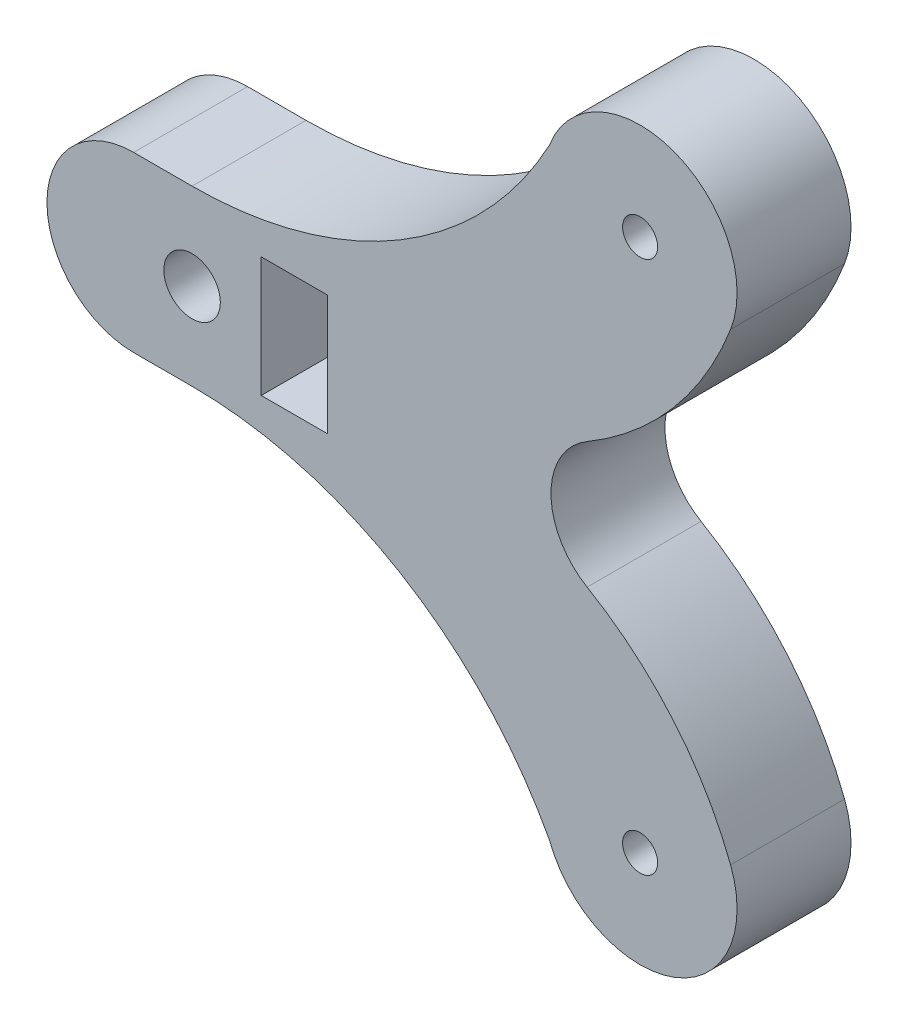
from build123d import *

# Parameters (mm, degrees)
SKETCH1_R           = 0.899963
SKETCH1_R_2         = 1.449813
SKETCH1_W           = 3.400011
SKETCH1_H           = 6.165182777
BOSS_EXTRUDE1_DEPTH = 5.85


with BuildPart() as part:
    # Sketch1 → Boss-Extrude1 (new body)
    with BuildSketch(Plane.XY):
        with BuildLine():
            Line((588.919699582, 439.815632013), (585.919699582, 439.815632013))
            ThreePointArc((585.919699582, 439.815632013), (581.469886582, 435.365819013), (585.919699582, 430.916006013))
            Line((585.919699582, 430.916006013), (588.919699582, 430.916006013))
            ThreePointArc((588.919699582, 430.916006013), (599.608353975, 427.959325253), (607.258051132, 419.92991511))
            ThreePointArc((607.258051132, 419.92991511), (613.686608593, 417.021299318), (616.564448765, 423.463692724))
            ThreePointArc((616.564448765, 423.463692724), (613.618665462, 428.422075059), (609.199860767, 432.128469496))
            ThreePointArc((609.199860767, 432.128469496), (607.343601507, 435.365819013), (609.199860767, 438.603168531))
            ThreePointArc((609.199860767, 438.603168531), (613.618665462, 442.309562968), (616.564448765, 447.267945303))
            ThreePointArc((616.564448765, 447.267945303), (613.686608593, 453.710338709), (607.258051132, 450.801722917))
            ThreePointArc((607.258051132, 450.801722917), (599.608353975, 442.772312774), (588.919699582, 439.815632013))
        make_face()
        with Locations((611.919699582, 449.057086685)):
            Circle(SKETCH1_R, mode=Mode.SUBTRACT)
        with Locations((611.919699582, 421.674551342)):
            Circle(SKETCH1_R, mode=Mode.SUBTRACT)
        with Locations((588.919699582, 435.365819013)):
            Circle(SKETCH1_R_2, mode=Mode.SUBTRACT)
        with Locations((594.169518082, 435.365819014)):
            Rectangle(SKETCH1_W, SKETCH1_H, mode=Mode.SUBTRACT)
    extrude(amount=BOSS_EXTRUDE1_DEPTH)


solid = part.part
